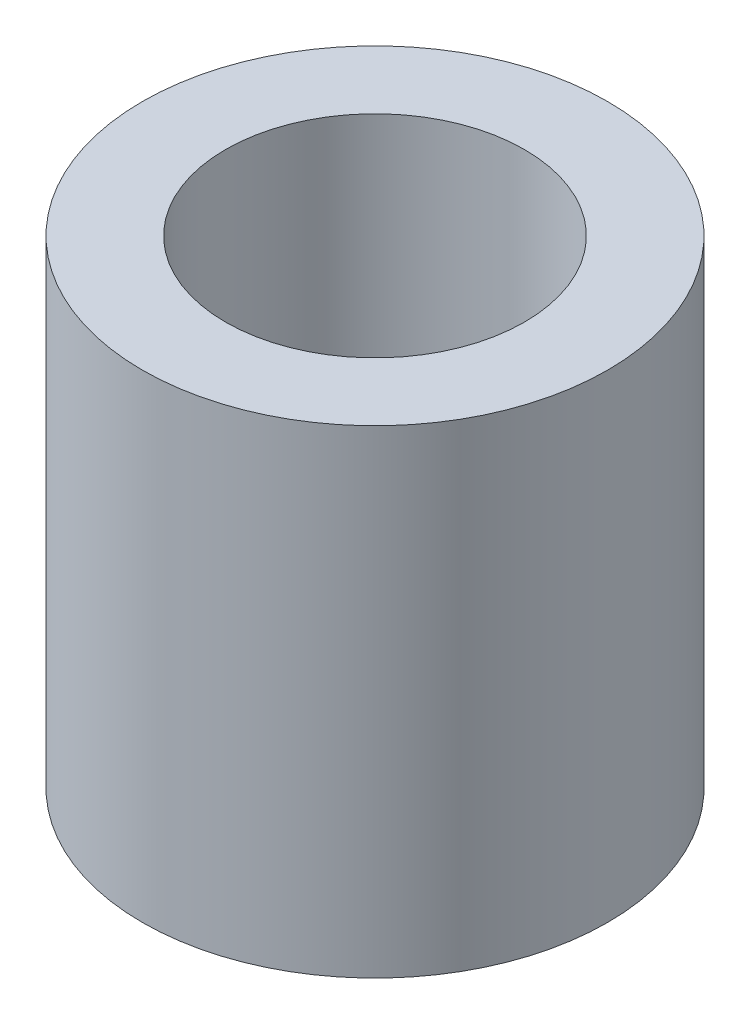
from build123d import *

# Parameters (mm, degrees)
SKETCH2_R           = 2.470439472
SKETCH2_R_2         = 1.5875
BOSS_EXTRUDE1_DEPTH = 5.08


with BuildPart() as part:
    # Sketch2 → Boss-Extrude1 (new body)
    with BuildSketch(Plane(origin=(0, 0, 0), x_dir=(1, 0, 0), z_dir=(0, 1, 0))):
        with Locations(Location((0, 0, 0), (0, 0, 270))):
            Circle(SKETCH2_R)
        with Locations(Location((0, 0, 0), (0, 0, 270))):
            Circle(SKETCH2_R_2, mode=Mode.SUBTRACT)
    extrude(amount=BOSS_EXTRUDE1_DEPTH)


solid = part.part
